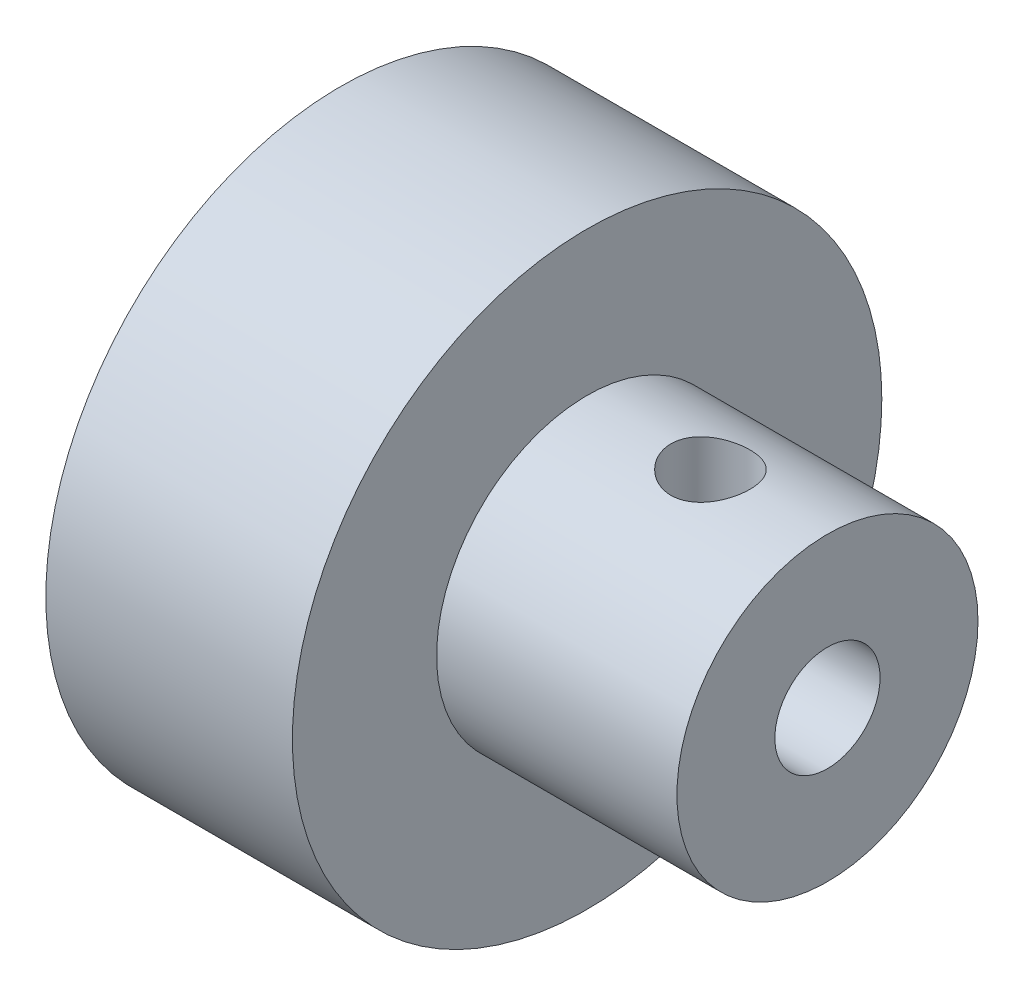
from build123d import *

# Parameters (mm, degrees)
CUT_EXTRUDE1_DEPTH      = 20.334926531
CUT_EXTRUDE1_DEPTH_BACK = 20.334926531
SKETCH2_R               = 1.190625


with BuildPart() as part:
    # Sketch1 → Revolve1 (revolve)
    with BuildSketch(Plane.XY):
        Polygon((0, 1.5875), (0, 4.540976685), (-7.250077802, 4.540976685), (-7.250077802, 8.89), (-14.689288069, 8.89), (-14.689288069, 1.5875), align=None)
    revolve(axis=Axis((0, 0, 0), (-1, 0, 0)))

    # Sketch2 → Cut-Extrude1 (cut, two sides: drawn at the far end of the back side and taken through both)
    with BuildSketch(Plane(origin=(0, 0, 0), x_dir=(1, 0, 0), z_dir=(0, 1, 0)).offset(-CUT_EXTRUDE1_DEPTH_BACK)):
        with Locations((-3.529556327, 0)):
            Circle(SKETCH2_R)
    extrude(amount=CUT_EXTRUDE1_DEPTH + CUT_EXTRUDE1_DEPTH_BACK, mode=Mode.SUBTRACT)


solid = part.part
